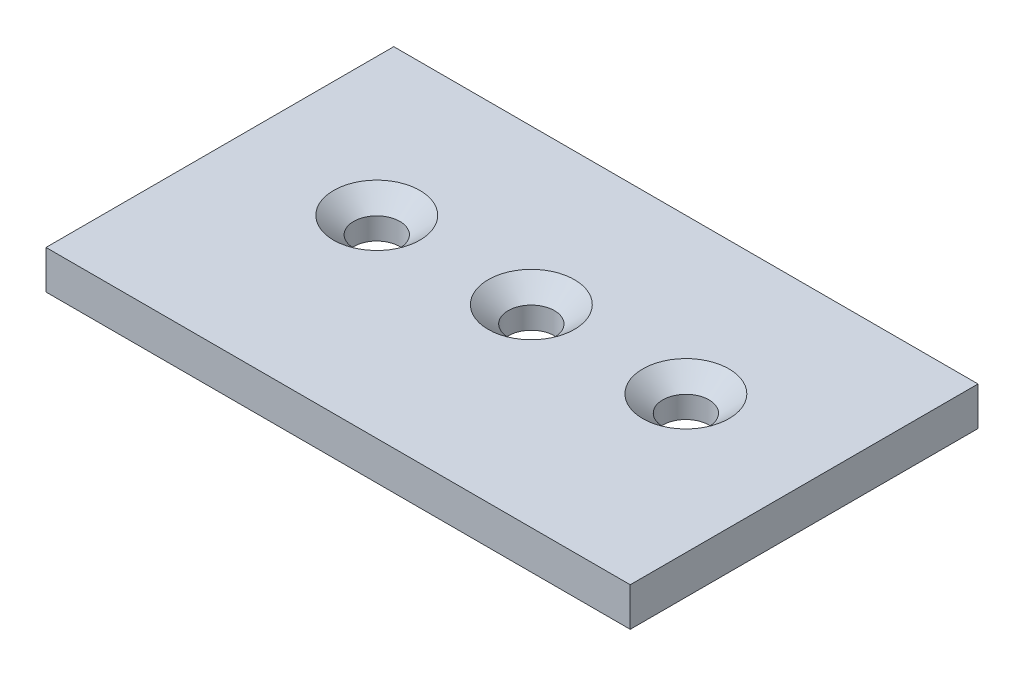
from build123d import *

# Parameters (mm, degrees)
SKETCH1_W                                         = 48.006
SKETCH1_H                                         = 28.575
BOSS_EXTRUDE1_DEPTH                               = 3.175
CSK_FOR_6_FLAT_HEAD_MACHINE_SCREW_100_D           = 3.7973
CSK_FOR_6_FLAT_HEAD_MACHINE_SCREW_100_CSINK_D     = 7.0866
CSK_FOR_6_FLAT_HEAD_MACHINE_SCREW_100_CSINK_ANGLE = 100
LPATTERN1_COUNT                                   = 2
LPATTERN1_PITCH                                   = 12.7
LPATTERN1_COL_COUNT                               = 2
LPATTERN1_COL_PITCH                               = 12.7


with BuildPart() as part:
    # Sketch1 → Boss-Extrude1 (new body)
    with BuildSketch(Plane(origin=(0, 0, 0), x_dir=(1, 0, 0), z_dir=(0, 1, 0))):
        with Locations((-24.003, 14.2875)):
            Rectangle(SKETCH1_W, SKETCH1_H)
    extrude(amount=BOSS_EXTRUDE1_DEPTH)

    # CSK for #6 Flat Head Machine Screw (100)1 (through all)
    with Locations(Plane(origin=(0, 3.175, 0), x_dir=(1, 0, 0), z_dir=(0, 1, 0))):
        with Locations((-24.003, 15.875)):
            csk_for_6_flat_head_machine_screw_100 = CounterSinkHole(CSK_FOR_6_FLAT_HEAD_MACHINE_SCREW_100_D / 2, CSK_FOR_6_FLAT_HEAD_MACHINE_SCREW_100_CSINK_D / 2, counter_sink_angle=CSK_FOR_6_FLAT_HEAD_MACHINE_SCREW_100_CSINK_ANGLE)

    # LPattern1: CSK for #6 Flat Head Machine Screw (100)1 ×2
    with Locations(*[(i * LPATTERN1_PITCH, 0, 0) for i in range(1, LPATTERN1_COUNT)]):
        add(csk_for_6_flat_head_machine_screw_100, mode=Mode.SUBTRACT)

    # LPattern1 col: CSK for #6 Flat Head Machine Screw (100)1 ×2
    with Locations(*[(-i * LPATTERN1_COL_PITCH, 0, 0) for i in range(1, LPATTERN1_COL_COUNT)]):
        add(csk_for_6_flat_head_machine_screw_100, mode=Mode.SUBTRACT)


solid = part.part
